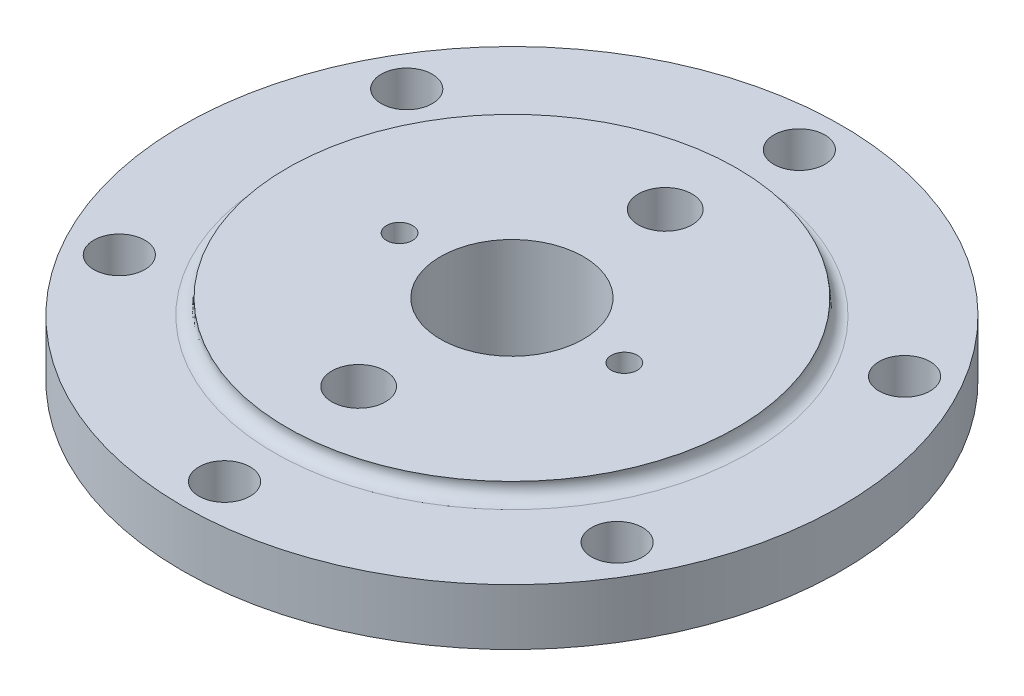
from build123d import *

# Parameters (mm, degrees)
SKETCH2_R              = 10
CUT_EXTRUDE1_DEPTH     = 210.076541008
M24_TAPPED_HOLE1_D     = 21
M24_TAPPED_HOLE1_DEPTH = 27
M24_TAPPED_HOLE1_TIP   = 6.3090365
M12_TAPPED_HOLE1_D     = 10.2
M12_TAPPED_HOLE1_DEPTH = 15
M12_TAPPED_HOLE1_TIP   = 3.064389157
SKETCH7_R              = 138
SKETCH7_R_2            = 129
CUT_EXTRUDE2_DEPTH     = 61


with BuildPart() as part:
    # Sketch1 → Revolve1 (revolve)
    with BuildSketch(Plane(origin=(0, 0, 0), x_dir=(0, 0, -1), z_dir=(1, 0, 0))):
        with BuildLine():
            Line((14, 0), (35, 0))
            Line((35, 0), (81, 47))
            Line((81, 47), (81, 53))
            Line((81, 53), (138, 53))
            Line((138, 53), (138, 75))
            Line((138, 75), (93.028360941, 75))
            ThreePointArc((93.028360941, 75), (89.114142828, 76.826684234), (88, 81))
            Line((88, 81), (28, 81))
            Line((28, 81), (28, 35.082903769))
            Line((28, 35.082903769), (14, 27))
            Line((14, 27), (14, 0))
        make_face()
    revolve(axis=Axis((0, 0, 0), (0, 1, 0)))

    # Sketch2 → Cut-Extrude1 (cut, through all)
    with BuildSketch(Plane(origin=(0, 75, 0), x_dir=(1, 0, 0), z_dir=(0, 1, 0))):
        with Locations(Location((0, 112.5, 0), (0, 0, 270))):
            Circle(SKETCH2_R)
        with Locations(Location((97.427857926, 56.25, 0), (0, 0, 270))):
            Circle(SKETCH2_R)
        with Locations(Location((97.427857926, -56.25, 0), (0, 0, 270))):
            Circle(SKETCH2_R)
        with Locations(Location((0, -112.5, 0), (0, 0, 270))):
            Circle(SKETCH2_R)
        with Locations(Location((-97.427857926, -56.25, 0), (0, 0, 270))):
            Circle(SKETCH2_R)
        with Locations(Location((-97.427857926, 56.25, 0), (0, 0, 270))):
            Circle(SKETCH2_R)
    extrude(amount=-CUT_EXTRUDE1_DEPTH, mode=Mode.SUBTRACT)

    # M24 Tapped Hole1
    with Locations(Plane(origin=(0, 81, 0), x_dir=(1, 0, 0), z_dir=(0, 1, 0))):
        with Locations((0, 60), (0, -60)):
            Hole(M24_TAPPED_HOLE1_D / 2, depth=M24_TAPPED_HOLE1_DEPTH)
            with Locations((0, 0, -(M24_TAPPED_HOLE1_DEPTH + M24_TAPPED_HOLE1_TIP / 2))):  # 118° drill point
                Cone(0, M24_TAPPED_HOLE1_D / 2, M24_TAPPED_HOLE1_TIP, mode=Mode.SUBTRACT)

    # M12 Tapped Hole1
    with Locations(Plane(origin=(0, 81, 0), x_dir=(1, 0, 0), z_dir=(0, 1, 0))):
        with Locations((-44, 0), (44, 0)):
            Hole(M12_TAPPED_HOLE1_D / 2, depth=M12_TAPPED_HOLE1_DEPTH)
            with Locations((0, 0, -(M12_TAPPED_HOLE1_DEPTH + M12_TAPPED_HOLE1_TIP / 2))):  # 118° drill point
                Cone(0, M12_TAPPED_HOLE1_D / 2, M12_TAPPED_HOLE1_TIP, mode=Mode.SUBTRACT)

    # Sketch7 → Cut-Extrude2 (cut)
    with BuildSketch(Plane(origin=(0, 81, 0), x_dir=(1, 0, 0), z_dir=(0, 1, 0))):
        Circle(SKETCH7_R)
        with Locations(Location((0, 0, 0), (0, 0, 270))):
            Circle(SKETCH7_R_2, mode=Mode.SUBTRACT)
    extrude(amount=-CUT_EXTRUDE2_DEPTH, mode=Mode.SUBTRACT)


solid = part.part
